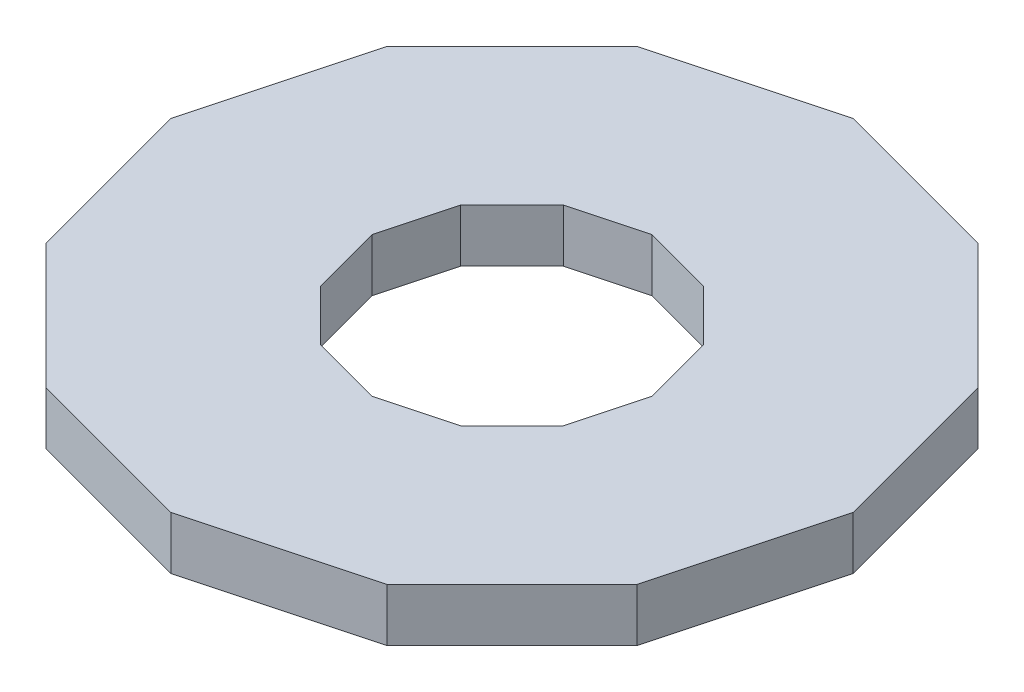
from build123d import *

# Parameters (mm, degrees)
BOSS_EXTRUDE2_DEPTH = 19.05


with BuildPart() as part:
    # Sketch2 → Boss-Extrude2 (new body)
    with BuildSketch(Plane(origin=(0, 0, 0), x_dir=(1, 0, 0), z_dir=(0, 1, 0))):
        Polygon((-122.672579939, 0), (-106.237570575, -61.336289969), (-61.336289969, -106.237570575), (0, -122.672579939), (61.336289969, -106.237570575), (106.237570575, -61.336289969), (122.672579939, 0), (106.237570575, 61.336289969), (61.336289969, 106.237570575), (0, 122.672579939), (-61.336289969, 106.237570575), (-106.237570575, 61.336289969), align=None)
        Polygon((-50.358538737, 0), (-43.611773844, -25.179269369), (-25.179269369, -43.611773844), (0, -50.358538737), (25.179269369, -43.611773844), (43.611773844, -25.179269369), (50.358538737, 0), (43.611773844, 25.179269369), (25.179269369, 43.611773844), (0, 50.358538737), (-25.179269369, 43.611773844), (-43.611773844, 25.179269369), align=None, mode=Mode.SUBTRACT)
    extrude(amount=BOSS_EXTRUDE2_DEPTH)


solid = part.part
